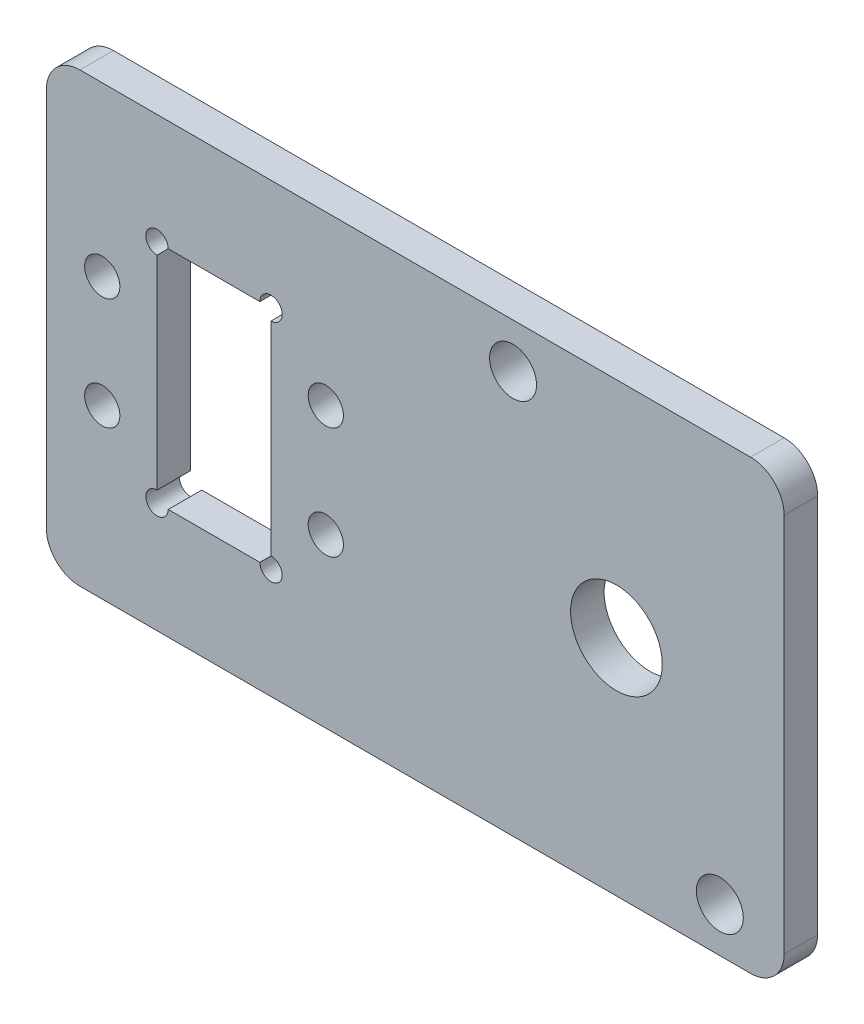
from build123d import *

# Parameters (mm, degrees)
SKETCH_1_W          = 66
SKETCH_1_H          = 40
EXTRUDE_1_DEPTH     = 3
SKETCH_2_R          = 1.575
SKETCH_2_R_2        = 4.1
SKETCH_2_R_3        = 2.1
SKETCH_2_W          = 10.2
SKETCH_2_H          = 20.2
CUT_EXTRUDE_1_DEPTH = 78.233412459
SKETCH_3_R          = 1
CUT_EXTRUDE_2_DEPTH = 78.233412459
FILLET_1_R          = 3


with BuildPart() as part:
    # 草图1 → 凸台-拉伸1 (new body)
    with BuildSketch(Plane.XY):
        with Locations((-33, -20)):
            Rectangle(SKETCH_1_W, SKETCH_1_H)
    extrude(amount=EXTRUDE_1_DEPTH)

    # 草图2 → 切除-拉伸1 (cut, through all)
    with BuildSketch(Plane.XY.offset(3)):
        with Locations((-61, -15)):
            Circle(SKETCH_2_R)
        with Locations(Location((-61, -25, 0), (0, 0, 180))):
            Circle(SKETCH_2_R)
        with Locations((-41, -25)):
            Circle(SKETCH_2_R)
        with Locations(Location((-41, -15, 0), (0, 0, 180))):
            Circle(SKETCH_2_R)
        with Locations((-15, -20)):
            Circle(SKETCH_2_R_2)
        with Locations((-24.25, -3.97853003)):
            Circle(SKETCH_2_R_3)
        with Locations((-5.75, -36.02146997)):
            Circle(SKETCH_2_R_3)
        with Locations((-51, -20)):
            Rectangle(SKETCH_2_W, SKETCH_2_H)
    extrude(amount=-CUT_EXTRUDE_1_DEPTH, mode=Mode.SUBTRACT)

    # 草图3 → 切除-拉伸2 (cut, through all)
    with BuildSketch(Plane.XY.offset(3)):
        with Locations((-45.9, -9.9)):
            Circle(SKETCH_3_R)
        with Locations((-45.9, -30.1)):
            Circle(SKETCH_3_R)
        with Locations((-56.1, -30.1)):
            Circle(SKETCH_3_R)
        with Locations((-56.1, -9.9)):
            Circle(SKETCH_3_R)
    extrude(amount=-CUT_EXTRUDE_2_DEPTH, mode=Mode.SUBTRACT)

    # 圆角1
    fillet_1_edges = [part.edges().sort_by_distance(p)[0] for p in [
        (0, -40, 1.5),
        (-66, -40, 1.5),
        (-66, 0, 1.5),
        (0, 0, 1.5),
    ]]
    fillet(fillet_1_edges, radius=FILLET_1_R)


solid = part.part
